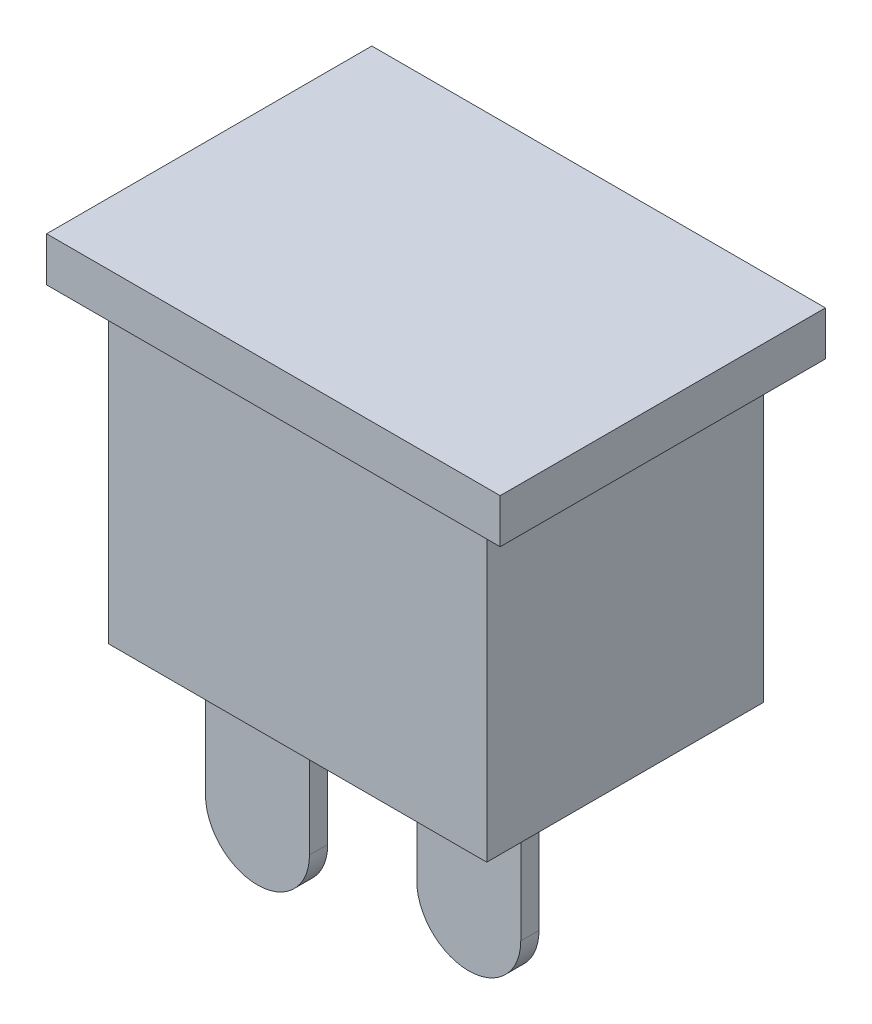
from build123d import *

# Parameters (mm, degrees)
SKETCH1_W           = 17.3609
SKETCH1_H           = 12.7
BOSS_EXTRUDE1_DEPTH = 13.97
SKETCH2_W           = 20.828
SKETCH2_H           = 14.9352
BOSS_EXTRUDE2_DEPTH = 2.032
SKETCH3_W           = 4.7752
SKETCH3_H           = 0.8382
BOSS_EXTRUDE3_DEPTH = 8.0772
FILLET1_RADIUS      = 2.3876
FILLET1_LENGTH      = 0.8382
FILLET2_RADIUS      = 2.3876
FILLET2_LENGTH      = 0.8382


with BuildPart() as part:
    # Sketch1 → Boss-Extrude1 (new body)
    with BuildSketch(Plane(origin=(0, 0, 0), x_dir=(1, 0, 0), z_dir=(0, 1, 0))):
        with Locations((8.68045, 6.35)):
            Rectangle(SKETCH1_W, SKETCH1_H)
    extrude(amount=-BOSS_EXTRUDE1_DEPTH)

    # Sketch2 → Boss-Extrude2 (add)
    with BuildSketch(Plane(origin=(0, 0, 0), x_dir=(1, 0, 0), z_dir=(0, 1, 0))):
        with Locations((8.68045, 6.35)):
            Rectangle(SKETCH2_W, SKETCH2_H)
    extrude(amount=BOSS_EXTRUDE2_DEPTH)

    # Sketch3 → Boss-Extrude3 (add)
    with BuildSketch(Plane.XZ.offset(13.97)):
        with Locations((4.9276, -2.3241)):
            Rectangle(SKETCH3_W, SKETCH3_H)
        with Locations((13.1953, -3.7592)):
            Rectangle(SKETCH3_W, SKETCH3_H)
    extrude(amount=BOSS_EXTRUDE3_DEPTH)

    # Fillet1: full round fillet: the end face becomes a half cylinder, R = half its width
    fillet1_face = Plane((4.9276, -22.0472, -2.3241), x_dir=(0, 0, -1), z_dir=(0, -1, 0))  # on the end face: x along it, z out of the body
    fillet1_slab = fillet1_face.offset(-FILLET1_RADIUS / 2) * Box(FILLET1_LENGTH, 2 * FILLET1_RADIUS, FILLET1_RADIUS, mode=Mode.PRIVATE)  # the body's end, R deep
    fillet1_round = Plane((4.9276, -19.6596, -2.3241), x_dir=(0, -1, 0), z_dir=(0, 0, -1)) * Cylinder(FILLET1_RADIUS, FILLET1_LENGTH, mode=Mode.PRIVATE)  # its axis R under the face
    add(fillet1_slab - fillet1_round, mode=Mode.SUBTRACT)

    # Fillet2: full round fillet: the end face becomes a half cylinder, R = half its width
    fillet2_face = Plane((13.1953, -22.0472, -3.7592), x_dir=(0, 0, -1), z_dir=(0, -1, 0))  # on the end face: x along it, z out of the body
    fillet2_slab = fillet2_face.offset(-FILLET2_RADIUS / 2) * Box(FILLET2_LENGTH, 2 * FILLET2_RADIUS, FILLET2_RADIUS, mode=Mode.PRIVATE)  # the body's end, R deep
    fillet2_round = Plane((13.1953, -19.6596, -3.7592), x_dir=(0, -1, 0), z_dir=(0, 0, -1)) * Cylinder(FILLET2_RADIUS, FILLET2_LENGTH, mode=Mode.PRIVATE)  # its axis R under the face
    add(fillet2_slab - fillet2_round, mode=Mode.SUBTRACT)


solid = part.part
